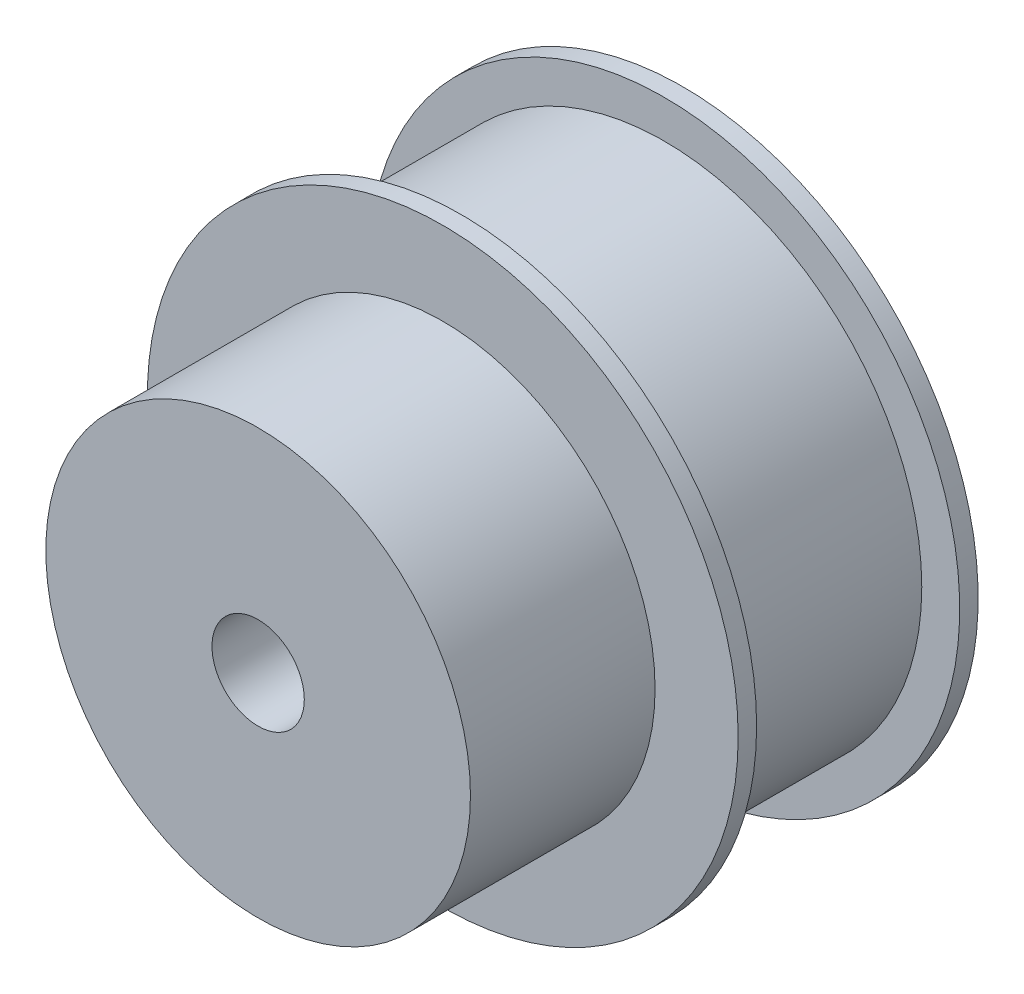
from build123d import *

# Parameters (mm, degrees)
SKETCH_1_R               = 11.5
EXTRUDE_1_DEPTH          = 10
SKETCH_2_R               = 13.945
EXTRUDE_2_DEPTH          = 13
SKETCH_3_R               = 16
EXTRUDE_3_DEPTH          = 1
EXTRUDE_START            = -1
SKETCH_4_R               = 16
EXTRUDE_4_DEPTH          = 1
CUT_EXTRUDE_1_DEPTH      = 33.26453161
CUT_EXTRUDE_1_DEPTH_BACK = 33.26453161
SKETCH_5_R               = 2.5


with BuildPart() as part:
    # 草图1 → 凸台-拉伸1 (new body)
    with BuildSketch(Plane.XY):
        Circle(SKETCH_1_R)
    extrude(amount=-EXTRUDE_1_DEPTH)

    # 草图2 → 凸台-拉伸2 (add)
    with BuildSketch(Plane(origin=(0, 0, -10), x_dir=(-1, 0, 0), z_dir=(0, 0, -1))):
        with Locations(Location((0, 0, 0), (0, 0, 180))):
            Circle(SKETCH_2_R)
    extrude(amount=EXTRUDE_2_DEPTH)

    # 草图3 → 凸台-拉伸3 (add)
    with BuildSketch(Plane(origin=(0, 0, -23), x_dir=(-1, 0, 0), z_dir=(0, 0, -1))):
        Circle(SKETCH_3_R)
    extrude(amount=-EXTRUDE_3_DEPTH)

    # 草图4 → 凸台-拉伸4 (add)
    with BuildSketch(Plane.XY.offset(-10).offset(EXTRUDE_START)):
        with Locations(Location((0, 0, 0), (0, 0, 180))):
            Circle(SKETCH_4_R)
    extrude(amount=EXTRUDE_4_DEPTH)

    # 草图5 → 切除-拉伸1 (cut, two sides: drawn at the far end of the back side and taken through both)
    with BuildSketch(Plane.XY.offset(-CUT_EXTRUDE_1_DEPTH_BACK)):
        Circle(SKETCH_5_R)
    extrude(amount=CUT_EXTRUDE_1_DEPTH + CUT_EXTRUDE_1_DEPTH_BACK, mode=Mode.SUBTRACT)


solid = part.part
